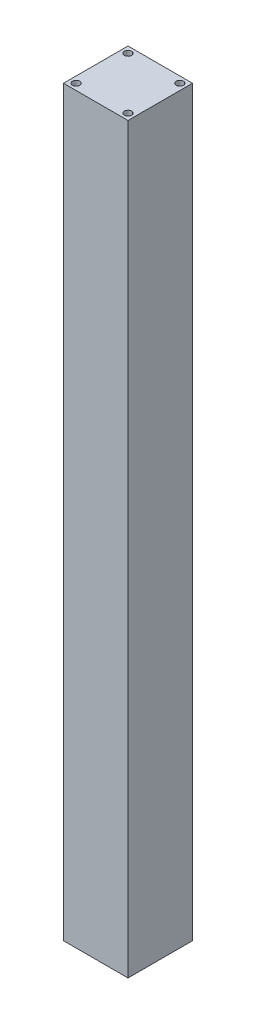
from build123d import *

# Parameters (mm, degrees)
SKETCH3_W           = 75
SKETCH3_H           = 75
BOSS_EXTRUDE1_DEPTH = 863.6
CUT_EXTRUDE1_START  = 863.6
SKETCH4_R           = 4.233291
CUT_EXTRUDE1_DEPTH  = 25.4


with BuildPart() as part:
    # Sketch3 → Boss-Extrude1 (new body)
    with BuildSketch(Plane(origin=(0, 0, 0), x_dir=(1, 0, 0), z_dir=(0, 1, 0))):
        with Locations((37.5, 37.5)):
            Rectangle(SKETCH3_W, SKETCH3_H)
    extrude(amount=BOSS_EXTRUDE1_DEPTH)

    # Sketch4 → Cut-Extrude1 (cut)
    with BuildSketch(Plane(origin=(0, 0, 0), x_dir=(1, 0, 0), z_dir=(0, 1, 0)).offset(CUT_EXTRUDE1_START)):
        with Locations(Location((7.3375, 67.6625, 0), (0, 0, 90))):
            Circle(SKETCH4_R)
        with Locations(Location((67.6625, 67.6625, 0), (0, 0, 90))):
            Circle(SKETCH4_R)
        with Locations(Location((7.3375, 7.3375, 0), (0, 0, 90))):
            Circle(SKETCH4_R)
        with Locations(Location((67.6625, 7.3375, 0), (0, 0, 90))):
            Circle(SKETCH4_R)
    extrude(amount=-CUT_EXTRUDE1_DEPTH, mode=Mode.SUBTRACT)


solid = part.part
